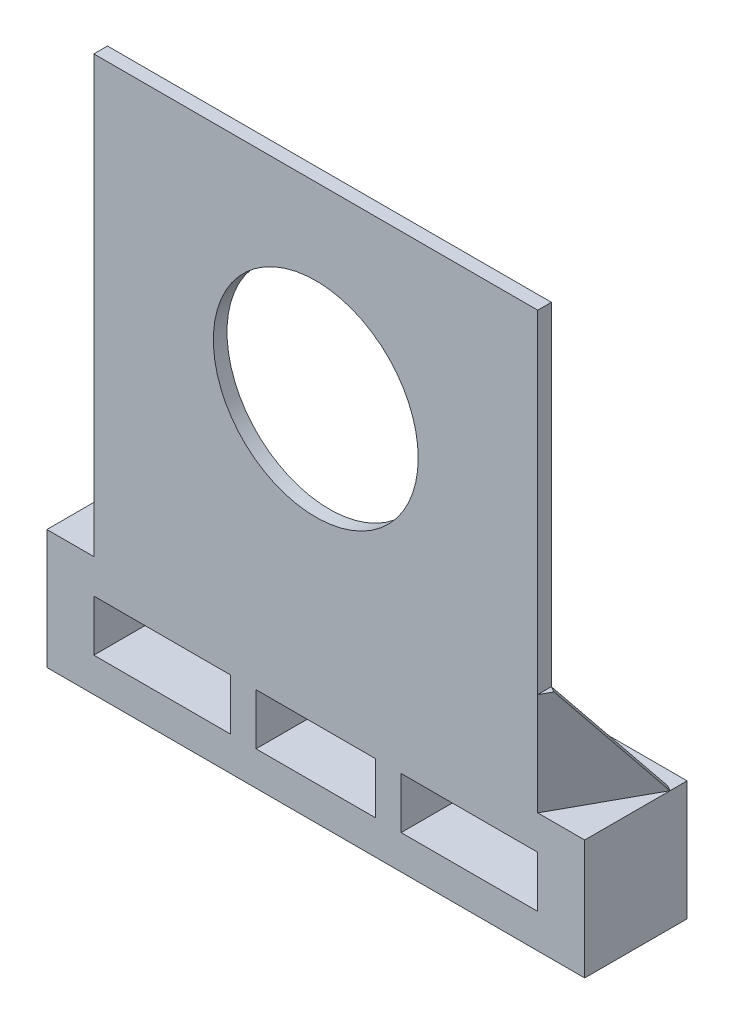
from build123d import *

# Parameters (mm, degrees)
SKETCH1_W           = 260
SKETCH1_H           = 255
SKETCH1_R           = 60
BOSS_EXTRUDE1_DEPTH = 8
SKETCH2_W           = 315
SKETCH2_H           = 70
SKETCH2_W_2         = 70
SKETCH2_H_2         = 30
SKETCH2_W_3         = 80
BOSS_EXTRUDE2_DEPTH = 60
BOSS_EXTRUDE3_DEPTH = 60
CUT_EXTRUDE1_DEPTH  = 345.113962788


with BuildPart() as part:
    # Sketch1 → Boss-Extrude1 (new body)
    with BuildSketch(Plane.XY):
        Rectangle(SKETCH1_W, SKETCH1_H)
        with Locations((0, 17.5)):
            Circle(SKETCH1_R, mode=Mode.SUBTRACT)
    extrude(amount=-BOSS_EXTRUDE1_DEPTH)

    # Sketch2 → Boss-Extrude2 (add)
    with BuildSketch(Plane.XY):
        with Locations((0, -162.5)):
            Rectangle(SKETCH2_W, SKETCH2_H)
        with Locations((0, -162.5)):
            Rectangle(SKETCH2_W_2, SKETCH2_H_2, mode=Mode.SUBTRACT)
        with Locations((90, -162.5)):
            Rectangle(SKETCH2_W_3, SKETCH2_H_2, mode=Mode.SUBTRACT)
        with Locations((-90, -162.5)):
            Rectangle(SKETCH2_W_3, SKETCH2_H_2, mode=Mode.SUBTRACT)
    extrude(amount=-BOSS_EXTRUDE2_DEPTH)

    # Sketch3 → Boss-Extrude3 (add)
    with BuildSketch(Plane(origin=(0, -127.5, 0), x_dir=(1, 0, 0), z_dir=(0, 1, 0))):
        Polygon((130, 0), (157.5, 50), (154.121880998, 51.857965451), (130, 8), align=None)
    boss_extrude3 = extrude(amount=BOSS_EXTRUDE3_DEPTH)

    # Sketch4 → Cut-Extrude1 (cut, through all)
    with BuildSketch(Plane(origin=(99.80806142, 0, 54.894433781), x_dir=(0.48191874977215704, 0, -0.8762159086766463), z_dir=(0.8762159086766464, 0, 0.48191874977215715))):
        Polygon((69.65916474, -67.5), (119.712998523, -127.5), (119.712998523, -67.5), align=None)
    cut_extrude1 = extrude(amount=-CUT_EXTRUDE1_DEPTH, mode=Mode.SUBTRACT)

    # Mirror1: Boss-Extrude3, Cut-Extrude1 across plane
    add(boss_extrude3.mirror(Plane(origin=(0, 0, 0), x_dir=(0, 0, 1), z_dir=(1, 0, 0))))
    add(cut_extrude1.mirror(Plane(origin=(0, 0, 0), x_dir=(0, 0, 1), z_dir=(1, 0, 0))), mode=Mode.SUBTRACT)


solid = part.part
